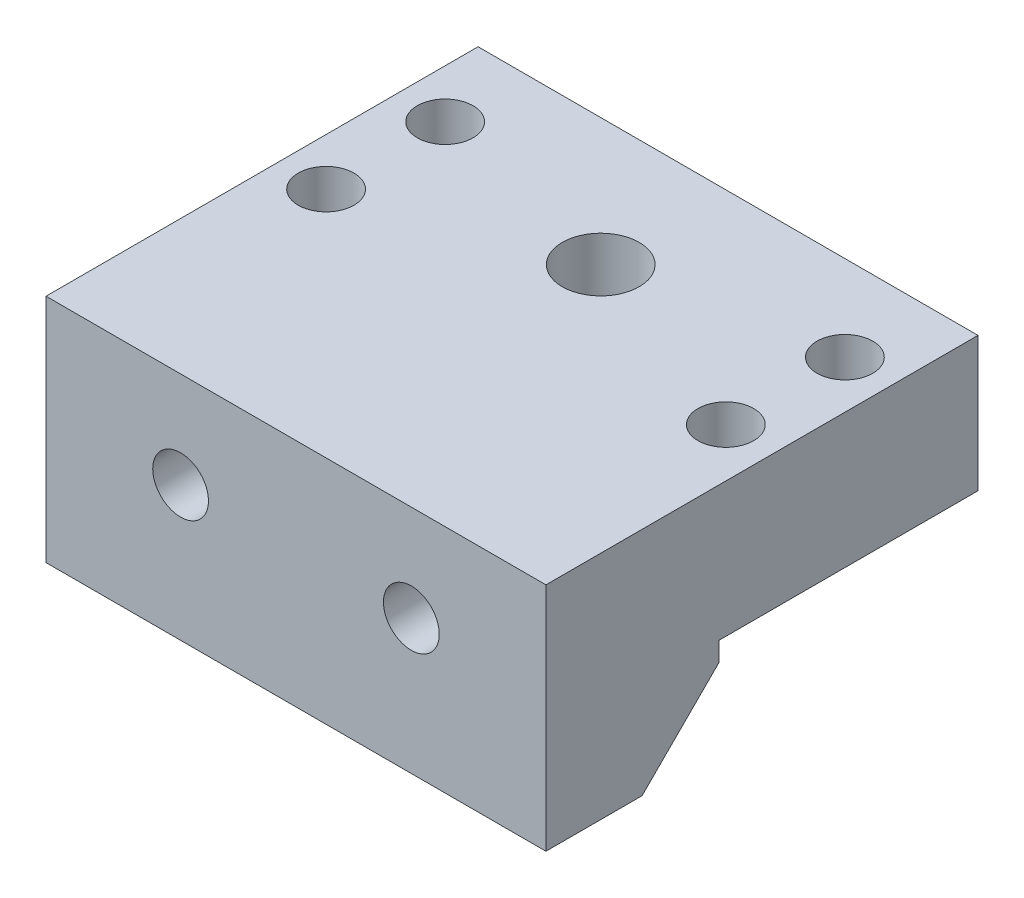
from build123d import *

# Parameters (mm, degrees)
SKETCH1_W            = 32
SKETCH1_H            = 26.941935484
SKETCH1_R            = 4
BOSS_EXTRUDE1_DEPTH  = 10
SKETCH2_W            = 10
SKETCH2_H            = 26.941935484
BOSS_EXTRUDE2_DEPTH  = 8
BOSS_EXTRUDE3_REACH  = 61.413
M5_CLEARANCE_HOLE1_D = 5.8
SKETCH6_W            = 52
SKETCH6_H            = 44.941935484
SKETCH6_R            = 4
BOSS_EXTRUDE4_DEPTH  = 6
M5_CLEARANCE_HOLE2_D = 5.8


with BuildPart() as part:
    # Sketch1 → Boss-Extrude1 (new body)
    with BuildSketch(Plane(origin=(0, 0, 0), x_dir=(1, 0, 0), z_dir=(0, 1, 0))):
        with Locations((16, 13.470967742)):
            Rectangle(SKETCH1_W, SKETCH1_H)
        with Locations(Location((16, 13.7, 0), (0, 0, 270))):
            Circle(SKETCH1_R, mode=Mode.SUBTRACT)
    extrude(amount=BOSS_EXTRUDE1_DEPTH)

    # Sketch2 → Boss-Extrude2 (add)
    with BuildSketch(Plane(origin=(0, 10, 0), x_dir=(1, 0, 0), z_dir=(0, 1, 0))):
        with Locations((-5, 13.470967742)):
            Rectangle(SKETCH2_W, SKETCH2_H)
        with Locations((37, 13.470967742)):
            Rectangle(SKETCH2_W, SKETCH2_H)
    extrude(amount=-BOSS_EXTRUDE2_DEPTH)

    # Boss-Extrude3: up to this face of the body (flat: up to its plane)
    boss_extrude3_end = Plane(part.part.faces().sort_by_distance((42, 6, -13.470967742))[0])
    # Sketch3 → Boss-Extrude3 (add, up to the picked face)
    with BuildSketch(Plane.ZY.offset(10), mode=Mode.PRIVATE) as boss_extrude3_sk1:
        Polygon((0, 0), (8, -8), (18, -8), (18, 10), (0, 10), align=None)
    boss_extrude3_tool1 = split(extrude(boss_extrude3_sk1.sketch, amount=-BOSS_EXTRUDE3_REACH, mode=Mode.PRIVATE), bisect_by=boss_extrude3_end, keep=Keep.BOTH, mode=Mode.PRIVATE)
    add(boss_extrude3_tool1.solids().sort_by(Axis((-10, 1.694064, 9.694064), (1, 0, 0)))[0])

    # M5 Clearance Hole1 (through all)
    with Locations(Plane(origin=(0, 0, -26.941935484), x_dir=(-1, 0, 0), z_dir=(0, 0, -1))):
        with Locations((-28, 6), (-4, 6)):
            Hole(M5_CLEARANCE_HOLE1_D / 2)

    # Sketch6 → Boss-Extrude4 (add)
    with BuildSketch(Plane(origin=(0, 10, 0), x_dir=(1, 0, 0), z_dir=(0, 1, 0))):
        with Locations((16, 4.470967742)):
            Rectangle(SKETCH6_W, SKETCH6_H)
        with Locations(Location((16, 13.7, 0), (0, 0, 270))):
            Circle(SKETCH6_R, mode=Mode.SUBTRACT)
    extrude(amount=BOSS_EXTRUDE4_DEPTH)

    # M5 Clearance Hole2 (through all)
    with Locations(Plane(origin=(0, 16, 0), x_dir=(1, 0, 0), z_dir=(0, 1, 0))):
        with Locations((37.04456925, 18.051391355), (36.92194463, 5.790370874), (-4.953330413, 18.47141973), (-5.075955034, 6.210399249)):
            Hole(M5_CLEARANCE_HOLE2_D / 2)


solid = part.part
